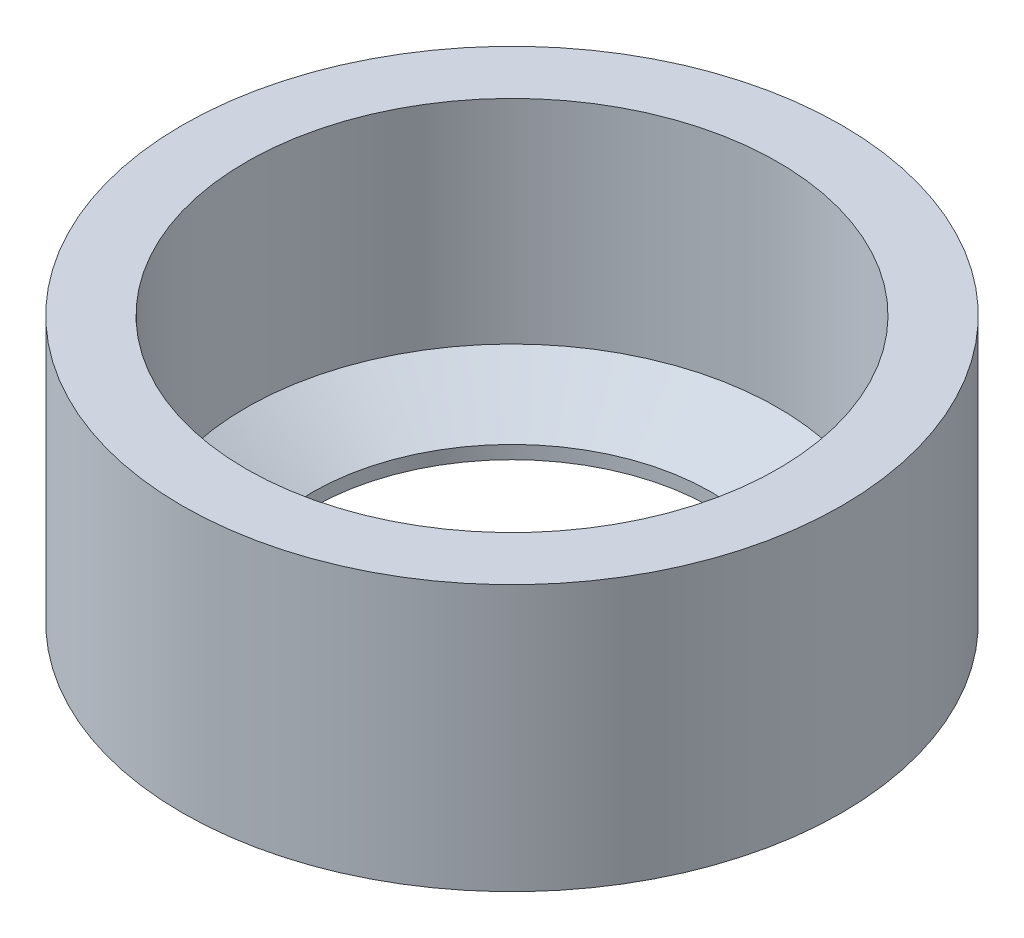
from build123d import *

# Parameters (mm, degrees)
SKETCH1_R                   = 15.748
BOSS_EXTRUDE1_DEPTH         = 12.7
F_1_1_DIAMETER_HOLE1_D      = 25.4
F_1_1_DIAMETER_HOLE1_DEPTH  = 10.16
F_1_1_DIAMETER_HOLE1_TIP    = 7.630929862
F_3_4_0_75_DIAMETER_HOLE1_D = 19.05


with BuildPart() as part:
    # Sketch1 → Boss-Extrude1 (new body)
    with BuildSketch(Plane(origin=(0, 0, 0), x_dir=(1, 0, 0), z_dir=(0, 1, 0))):
        with Locations(Location((0, 0, 0), (0, 0, 270))):
            Circle(SKETCH1_R)
    extrude(amount=BOSS_EXTRUDE1_DEPTH)

    # 1 (1) Diameter Hole1
    with Locations(Plane.ZX.offset(12.7)):
        with Locations((0, 0)):
            Hole(F_1_1_DIAMETER_HOLE1_D / 2, depth=F_1_1_DIAMETER_HOLE1_DEPTH)
            with Locations((0, 0, -(F_1_1_DIAMETER_HOLE1_DEPTH + F_1_1_DIAMETER_HOLE1_TIP / 2))):  # 118° drill point
                Cone(0, F_1_1_DIAMETER_HOLE1_D / 2, F_1_1_DIAMETER_HOLE1_TIP, mode=Mode.SUBTRACT)

    # 3/4 (0.75) Diameter Hole1 (through all)
    with Locations(Plane.ZX.offset(12.7)):
        with Locations((0, 0)):
            Hole(F_3_4_0_75_DIAMETER_HOLE1_D / 2)


solid = part.part
